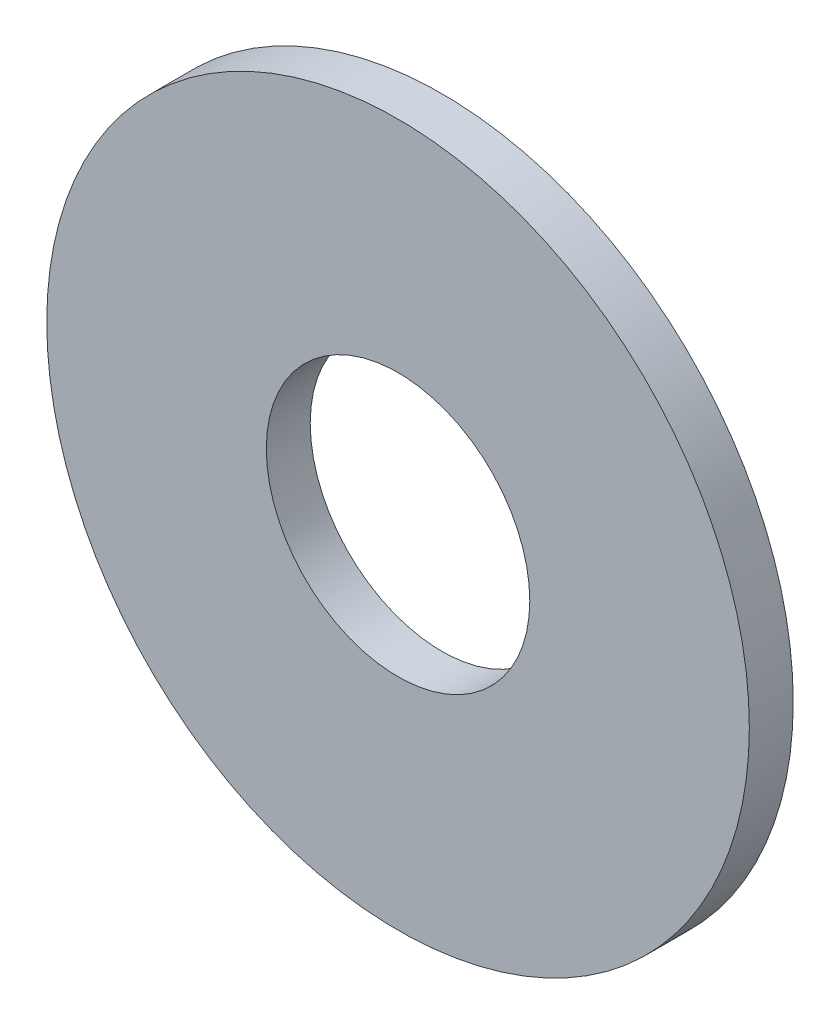
from build123d import *

# Parameters (mm, degrees)
SKETCH1_R           = 8
BOSS_EXTRUDE1_DEPTH = 10
SKETCH2_R           = 8
CUT_EXTRUDE1_DEPTH  = 9
SKETCH3_R           = 3
CUT_EXTRUDE2_DEPTH  = 9


with BuildPart() as part:
    # Sketch1 → Boss-Extrude1 (new body)
    with BuildSketch(Plane.XY):
        Circle(SKETCH1_R)
    extrude(amount=BOSS_EXTRUDE1_DEPTH)

    # Sketch2 → Cut-Extrude1 (cut)
    with BuildSketch(Plane(origin=(0, 0, 0), x_dir=(-1, 0, 0), z_dir=(0, 0, -1))):
        Circle(SKETCH2_R)
    extrude(amount=-CUT_EXTRUDE1_DEPTH, mode=Mode.SUBTRACT)

    # Sketch3 → Cut-Extrude2 (cut)
    with BuildSketch(Plane(origin=(0, 0, 9), x_dir=(-1, 0, 0), z_dir=(0, 0, -1))):
        Circle(SKETCH3_R)
    extrude(amount=-CUT_EXTRUDE2_DEPTH, mode=Mode.SUBTRACT)


solid = part.part
